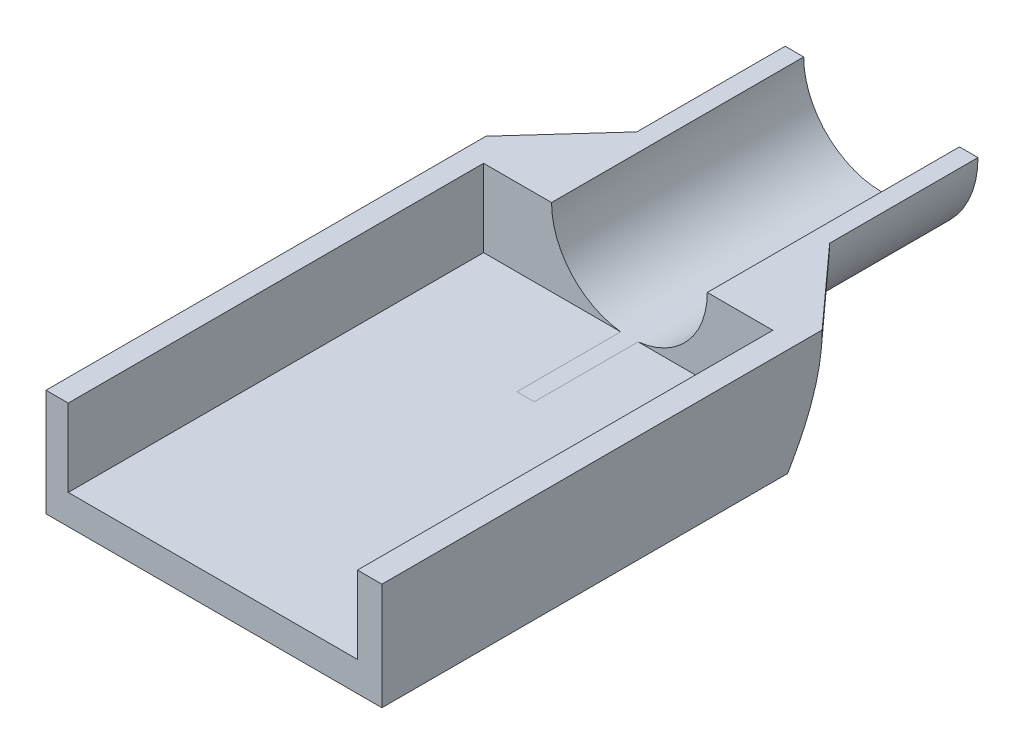
from build123d import *

# Parameters (mm, degrees)
CUT_EXTRUDE6_DEPTH  = 75
CUT_EXTRUDE7_DEPTH  = 48
SKETCH11_W          = 39
SKETCH11_H          = 22
CUT_EXTRUDE8_DEPTH  = 56
SKETCH14_W          = 50.821005264
SKETCH14_H          = 8.659157084
SKETCH14_W_2        = 55.150583806
SKETCH14_H_2        = 9.071497897
CUT_EXTRUDE11_DEPTH = 90
SKETCH15_W          = 52.591955303
SKETCH15_H          = 17.949813053
CUT_EXTRUDE12_DEPTH = 100


with BuildPart() as part:
    # Sketch1 → Revolve1 (revolve)
    with BuildSketch(Plane(origin=(0, 0, 0), x_dir=(1, 0, 0), z_dir=(0, 1, 0))):
        Polygon((-14.084428196, 16.517586435), (-1.084428196, 16.517586435), (-1.084428196, -3.482413565), (17.915571804, -24.482413565), (17.915571804, -73.482413565), (-14.084428196, -73.482413565), align=None)
    revolve(axis=Axis((-14.084428196, 0, 73.482413565), (0, 0, -1)))

    # Sketch7 → Cut-Extrude6 (cut)
    with BuildSketch(Plane.XY.offset(73.482413565)):
        with BuildLine():
            ThreePointArc((8.542988801, 22.627416998), (-1.838558361, 29.56414504), (-14.084428196, 32))
            Line((-14.084428196, 32), (-14.084428196, 22.627416998))
            Line((-14.084428196, 22.627416998), (8.542988801, 22.627416998))
        make_face()
        with BuildLine():
            Line((-14.084428196, 22.627416998), (-14.084428196, 32))
            ThreePointArc((-14.084428196, 32), (-26.330298032, 29.56414504), (-36.711845194, 22.627416998))
            Line((-36.711845194, 22.627416998), (-14.084428196, 22.627416998))
        make_face()
        with BuildLine():
            Line((-36.747904754, 0), (-36.747904754, 22.591299881))
            ThreePointArc((-36.747904754, 22.591299881), (-43.658329274, 12.222290091), (-46.084428196, 0))
            Line((-46.084428196, 0), (-36.747904754, 0))
        make_face()
        with BuildLine():
            Line((-36.747904754, -22.591299881), (-36.747904754, 0))
            Line((-36.747904754, 0), (-46.084428196, 0))
            ThreePointArc((-46.084428196, 0), (-43.658329274, -12.222290091), (-36.747904754, -22.591299881))
        make_face()
        with BuildLine():
            Line((-14.084428196, -32), (-14.084428196, -22.591299881))
            Line((-14.084428196, -22.591299881), (-36.747904754, -22.591299881))
            ThreePointArc((-36.747904754, -22.591299881), (-26.353869989, -29.554370203), (-14.084428196, -32))
        make_face()
        with BuildLine():
            ThreePointArc((17.915571804, 0), (15.479716844, 12.245869836), (8.542988801, 22.627416998))
            Line((8.542988801, 22.627416998), (8.542988801, 0))
            Line((8.542988801, 0), (17.915571804, 0))
        make_face()
        with BuildLine():
            Line((17.915571804, 0), (8.542988801, 0))
            Line((8.542988801, 0), (8.542988801, -22.591299881))
            Line((8.542988801, -22.591299881), (-14.084428196, -22.591299881))
            Line((-14.084428196, -22.591299881), (-14.084428196, -32))
            ThreePointArc((-14.084428196, -32), (8.542988801, -22.627416998), (17.915571804, 0))
        make_face()
    extrude(amount=-CUT_EXTRUDE6_DEPTH, mode=Mode.SUBTRACT)

    # Sketch10 → Cut-Extrude7 (cut)
    with BuildSketch(Plane(origin=(0, 0, -16.517586435), x_dir=(-1, 0, 0), z_dir=(0, 0, -1))):
        with BuildLine():
            ThreePointArc((24.584428196, 0), (21.509049399, 7.424621202), (14.084428196, 10.5))
            Line((14.084428196, 10.5), (14.084428196, 0))
            Line((14.084428196, 0), (24.584428196, 0))
        make_face()
        with BuildLine():
            Line((14.084428196, 0), (14.084428196, 10.5))
            ThreePointArc((14.084428196, 10.5), (6.659806994, 7.424621202), (3.584428196, 0))
            Line((3.584428196, 0), (14.084428196, 0))
        make_face()
        with BuildLine():
            Line((24.584428196, 0), (14.084428196, 0))
            Line((14.084428196, 0), (14.084428196, -10.5))
            ThreePointArc((14.084428196, -10.5), (21.509049399, -7.424621202), (24.584428196, 0))
        make_face()
        with BuildLine():
            Line((14.084428196, -10.5), (14.084428196, 0))
            Line((14.084428196, 0), (3.584428196, 0))
            ThreePointArc((3.584428196, 0), (6.659806994, -7.424621202), (14.084428196, -10.5))
        make_face()
    extrude(amount=-CUT_EXTRUDE7_DEPTH, mode=Mode.SUBTRACT)

    # Sketch11 → Cut-Extrude8 (cut)
    with BuildSketch(Plane.XY.offset(73.482413565)):
        with Locations((-14.247904754, 0.565694089)):
            Rectangle(SKETCH11_W, SKETCH11_H)
    extrude(amount=-CUT_EXTRUDE8_DEPTH, mode=Mode.SUBTRACT)

    # Sketch14 → Cut-Extrude11 (cut)
    with BuildSketch(Plane.XY.offset(73.482413565)):
        with Locations((-14.154000578, 19.895272631)):
            Rectangle(SKETCH14_W, SKETCH14_H)
        with Locations((-15.391023019, -18.97005486)):
            Rectangle(SKETCH14_W_2, SKETCH14_H_2)
    extrude(amount=-CUT_EXTRUDE11_DEPTH, mode=Mode.SUBTRACT)

    # Sketch15 → Cut-Extrude12 (cut)
    with BuildSketch(Plane(origin=(0, 0, -16.517586435), x_dir=(-1, 0, 0), z_dir=(0, 0, -1))):
        with Locations((12.823626237, 8.974906526)):
            Rectangle(SKETCH15_W, SKETCH15_H)
    extrude(amount=-CUT_EXTRUDE12_DEPTH, mode=Mode.SUBTRACT)


solid = part.part
